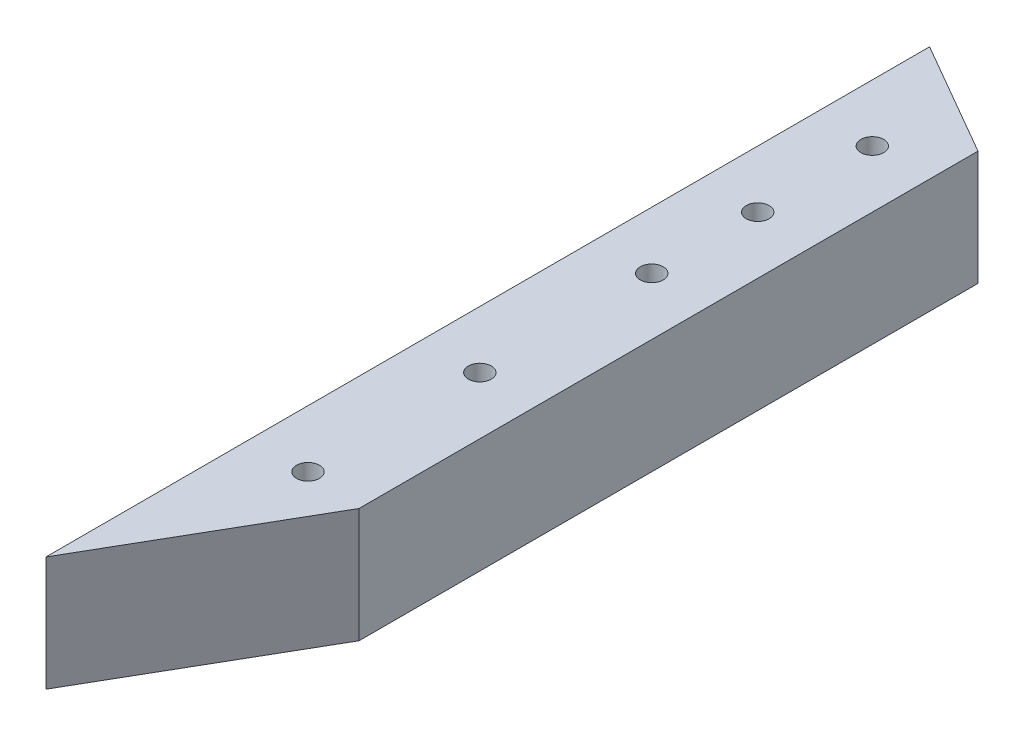
from build123d import *

# Parameters (mm, degrees)
SKETCH_1_W               = 20
SKETCH_1_H               = 20
EXTRUDE_1_DEPTH          = 154.23
CUT_EXTRUDE_1_DEPTH      = 154.23
CUT_EXTRUDE_2_DEPTH      = 157.802081938
CUT_EXTRUDE_2_DEPTH_BACK = 157.802081938
SKETCH_3_R               = 2


with BuildPart() as part:
    # 草图1 → 凸台-拉伸1 (new body)
    with BuildSketch(Plane.XY):
        with Locations((10, 10)):
            Rectangle(SKETCH_1_W, SKETCH_1_H)
    extrude(amount=EXTRUDE_1_DEPTH)

    # 草图2 → 切除-拉伸1 (cut)
    with BuildSketch(Plane(origin=(0, 20, 0), x_dir=(1, 0, 0), z_dir=(0, 1, 0))):
        Polygon((0, -154.23), (20, -119.588983849), (20, -154.23), align=None)
        Polygon((20, -11.547005384), (0, 0), (20, 0), align=None)
    extrude(amount=-CUT_EXTRUDE_1_DEPTH, mode=Mode.SUBTRACT)

    # 草图3 → 切除-拉伸2 (cut, two sides: drawn at the far end of the back side and taken through both)
    with BuildSketch(Plane(origin=(0, 20, 0), x_dir=(1, 0, 0), z_dir=(0, 1, 0)).offset(-CUT_EXTRUDE_2_DEPTH_BACK)):
        with Locations(Location((10, -88.5, 0), (0, 0, 270))):
            Circle(SKETCH_3_R)
        with Locations(Location((10, -118.5, 0), (0, 0, 270))):
            Circle(SKETCH_3_R)
        with Locations(Location((10, -58.5, 0), (0, 0, 270))):
            Circle(SKETCH_3_R)
        with Locations(Location((10, -20, 0), (0, 0, 270))):
            Circle(SKETCH_3_R)
        with Locations(Location((10, -40, 0), (0, 0, 270))):
            Circle(SKETCH_3_R)
    extrude(amount=CUT_EXTRUDE_2_DEPTH + CUT_EXTRUDE_2_DEPTH_BACK, mode=Mode.SUBTRACT)


solid = part.part
